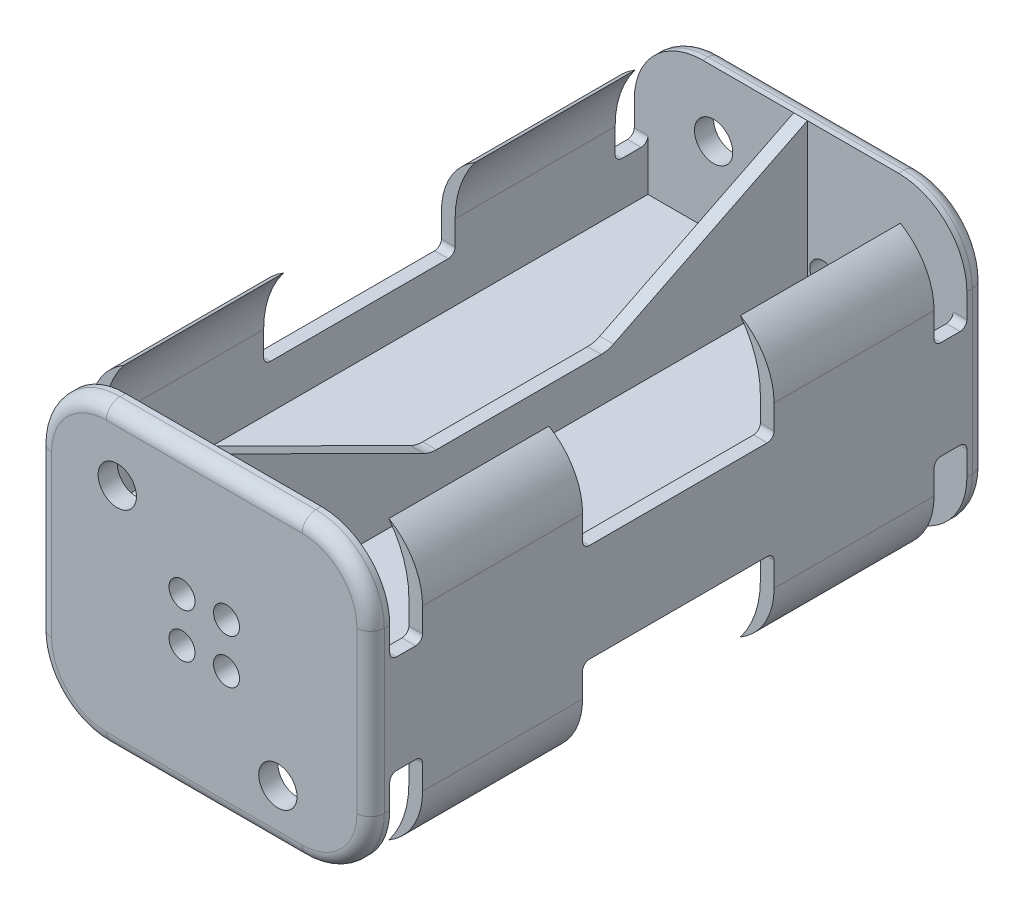
from build123d import *

# Parameters (mm, degrees)
SKETCH1_R           = 1.778
SKETCH1_R_2         = 1.2065
BOSS_EXTRUDE1_DEPTH = 57.15
CUT_EXTRUDE1_DEPTH  = 53.594
CUT_EXTRUDE2_DEPTH  = 8.128
FILLET2_R           = 1.27
FILLET3_R           = 1.27
CUT_EXTRUDE3_DEPTH  = 3.048


with BuildPart() as part:
    # Sketch1 → Boss-Extrude1 (new body)
    with BuildSketch(Plane.XY):
        with BuildLine():
            Line((-9.0932, 13.8049), (9.0932, 13.8049))
            ThreePointArc((9.0932, 13.8049), (13.583328061, 11.945028061), (15.4432, 7.4549))
            Line((15.4432, 7.4549), (15.4432, -7.4549))
            ThreePointArc((15.4432, -7.4549), (13.583328061, -11.945028061), (9.0932, -13.8049))
            Line((9.0932, -13.8049), (-9.0932, -13.8049))
            ThreePointArc((-9.0932, -13.8049), (-13.583328061, -11.945028061), (-15.4432, -7.4549))
            Line((-15.4432, -7.4549), (-15.4432, 7.4549))
            ThreePointArc((-15.4432, 7.4549), (-13.583328061, 11.945028061), (-9.0932, 13.8049))
        make_face()
        with Locations((-8.0772, 7.7851)):
            Circle(SKETCH1_R, mode=Mode.SUBTRACT)
        with Locations(Location((6.834359756, -8.896092883, 0), (0, 0, 180))):
            Circle(SKETCH1_R, mode=Mode.SUBTRACT)
        with Locations((2.065458908, 2.065458908)):
            Circle(SKETCH1_R_2, mode=Mode.SUBTRACT)
        with Locations((2.065458908, -2.065458908)):
            Circle(SKETCH1_R_2, mode=Mode.SUBTRACT)
        with Locations((-2.065458908, -2.065458908)):
            Circle(SKETCH1_R_2, mode=Mode.SUBTRACT)
        with Locations((-2.065458908, 2.065458908)):
            Circle(SKETCH1_R_2, mode=Mode.SUBTRACT)
    extrude(amount=BOSS_EXTRUDE1_DEPTH)

    # Sketch2 → Cut-Extrude1 (cut)
    with BuildSketch(Plane(origin=(0, 0, 1.778), x_dir=(-1, 0, 0), z_dir=(0, 0, -1))):
        with BuildLine():
            Line((-12.315875439, 12.926358947), (-12.315875439, 13.8049))
            Line((-12.315875439, 13.8049), (-0.635, 13.8049))
            Line((-0.635, 13.8049), (-0.635, 0.4699))
            Line((-0.635, 0.4699), (-14.1732, 0.4699))
            Line((-14.1732, 0.4699), (-14.1732, 7.4549))
            ThreePointArc((-14.1732, 7.4549), (-13.696211827, 10.343953372), (-12.315875439, 12.926358947))
        make_face()
        with BuildLine():
            Line((14.1732, 0.4699), (0.635, 0.4699))
            Line((0.635, 0.4699), (0.635, 13.8049))
            Line((0.635, 13.8049), (12.315875439, 13.8049))
            Line((12.315875439, 13.8049), (12.315875439, 12.926358947))
            ThreePointArc((12.315875439, 12.926358947), (13.696211827, 10.343953372), (14.1732, 7.4549))
            Line((14.1732, 7.4549), (14.1732, 0.4699))
        make_face()
        with BuildLine():
            Line((-14.1732, -7.4549), (-14.1732, -0.4699))
            Line((-14.1732, -0.4699), (-0.635, -0.4699))
            Line((-0.635, -0.4699), (-0.635, -13.8049))
            Line((-0.635, -13.8049), (-12.315875439, -13.8049))
            Line((-12.315875439, -13.8049), (-12.315875439, -12.926358947))
            ThreePointArc((-12.315875439, -12.926358947), (-13.696211827, -10.343953372), (-14.1732, -7.4549))
        make_face()
        with BuildLine():
            Line((14.1732, -0.4699), (0.635, -0.4699))
            Line((0.635, -0.4699), (0.635, -13.8049))
            Line((0.635, -13.8049), (12.315875439, -13.8049))
            Line((12.315875439, -13.8049), (12.315875439, -12.926358947))
            ThreePointArc((12.315875439, -12.926358947), (13.696211827, -10.343953372), (14.1732, -7.4549))
            Line((14.1732, -7.4549), (14.1732, -0.4699))
        make_face()
    extrude(amount=-CUT_EXTRUDE1_DEPTH, mode=Mode.SUBTRACT)

    # Sketch3 → Cut-Extrude2 (cut)
    with BuildSketch(Plane.ZY.offset(15.4432)):
        with BuildLine():
            Line((1.778, 12.926358947), (1.778, 5.207))
            ThreePointArc((1.778, 5.207), (1.963987194, 4.757987194), (2.413, 4.572))
            Line((2.413, 4.572), (4.191, 4.572))
            ThreePointArc((4.191, 4.572), (4.640012806, 4.757987194), (4.826, 5.207))
            Line((4.826, 5.207), (4.826, 12.926358947))
            Line((4.826, 12.926358947), (1.778, 12.926358947))
        make_face()
        with BuildLine():
            Line((54.737, 4.572), (52.959, 4.572))
            ThreePointArc((52.959, 4.572), (52.509987194, 4.757987194), (52.324, 5.207))
            Line((52.324, 5.207), (52.324, 12.926358947))
            Line((52.324, 12.926358947), (55.372, 12.926358947))
            Line((55.372, 12.926358947), (55.372, 5.207))
            ThreePointArc((55.372, 5.207), (55.186012806, 4.757987194), (54.737, 4.572))
        make_face()
        with BuildLine():
            Line((2.413, -4.572), (4.191, -4.572))
            ThreePointArc((4.191, -4.572), (4.640012806, -4.757987194), (4.826, -5.207))
            Line((4.826, -5.207), (4.826, -12.926358947))
            Line((4.826, -12.926358947), (1.778, -12.926358947))
            Line((1.778, -12.926358947), (1.778, -5.207))
            ThreePointArc((1.778, -5.207), (1.963987194, -4.757987194), (2.413, -4.572))
        make_face()
        with BuildLine():
            Line((54.737, -4.572), (52.959, -4.572))
            ThreePointArc((52.959, -4.572), (52.509987194, -4.757987194), (52.324, -5.207))
            Line((52.324, -5.207), (52.324, -12.926358947))
            Line((52.324, -12.926358947), (55.372, -12.926358947))
            Line((55.372, -12.926358947), (55.372, -5.207))
            ThreePointArc((55.372, -5.207), (55.186012806, -4.757987194), (54.737, -4.572))
        make_face()
        with BuildLine():
            Line((19.685, 12.926358947), (37.465, 12.926358947))
            Line((37.465, 12.926358947), (37.465, 5.207))
            ThreePointArc((37.465, 5.207), (37.279012806, 4.757987194), (36.83, 4.572))
            Line((36.83, 4.572), (20.32, 4.572))
            ThreePointArc((20.32, 4.572), (19.870987194, 4.757987194), (19.685, 5.207))
            Line((19.685, 5.207), (19.685, 12.926358947))
        make_face()
        with BuildLine():
            Line((37.465, -12.926358947), (37.465, -5.207))
            ThreePointArc((37.465, -5.207), (37.279012806, -4.757987194), (36.83, -4.572))
            Line((36.83, -4.572), (20.32, -4.572))
            ThreePointArc((20.32, -4.572), (19.870987194, -4.757987194), (19.685, -5.207))
            Line((19.685, -5.207), (19.685, -12.926358947))
            Line((19.685, -12.926358947), (37.465, -12.926358947))
        make_face()
    cut_extrude2 = extrude(amount=-CUT_EXTRUDE2_DEPTH, mode=Mode.SUBTRACT)

    # Mirror1: Cut-Extrude2 across plane
    add(cut_extrude2.mirror(Plane(origin=(0, 0, 0), x_dir=(0, 0, 1), z_dir=(1, 0, 0))), mode=Mode.SUBTRACT)

    # Fillet2
    fillet2_edges = [part.edges().sort_by_distance(p)[0] for p in [
        (-13.583328061, 11.945028061, 57.15),
        (-15.4432, 0, 57.15),
        (-13.583328061, -11.945028061, 57.15),
        (0, -13.8049, 57.15),
        (13.583328061, -11.945028061, 57.15),
        (15.4432, 0, 57.15),
        (13.583328061, 11.945028061, 57.15),
        (0, 13.8049, 57.15),
    ]]
    fillet(fillet2_edges, radius=FILLET2_R)

    # Fillet3
    fillet3_edges = [part.edges().sort_by_distance(p)[0] for p in [
        (0, 13.8049, 0),
        (13.583328061, 11.945028061, 0),
        (15.4432, 0, 0),
        (13.583328061, -11.945028061, 0),
        (0, -13.8049, 0),
        (-13.583328061, -11.945028061, 0),
        (-15.4432, 0, 0),
        (-13.583328061, 11.945028061, 0),
    ]]
    fillet(fillet3_edges, radius=FILLET3_R)

    # Sketch4 → Cut-Extrude3 (cut)
    with BuildSketch(Plane(origin=(0.635, 0, 0), x_dir=(0, 0, -1), z_dir=(1, 0, 0))):
        with BuildLine():
            Line((-20.917407266, 4.572), (-36.232592734, 4.572))
            ThreePointArc((-36.232592734, 4.572), (-36.814131461, 4.63946836), (-37.364776122, 4.838289206))
            Line((-37.364776122, 4.838289206), (-55.372, 13.8049))
            Line((-55.372, 13.8049), (-1.778, 13.8049))
            Line((-1.778, 13.8049), (-19.785223878, 4.838289206))
            ThreePointArc((-19.785223878, 4.838289206), (-20.335868539, 4.63946836), (-20.917407266, 4.572))
        make_face()
        with BuildLine():
            Line((-55.372, -13.8049), (-1.778, -13.8049))
            Line((-1.778, -13.8049), (-19.785223878, -4.838289206))
            ThreePointArc((-19.785223878, -4.838289206), (-20.335868539, -4.63946836), (-20.917407266, -4.572))
            Line((-20.917407266, -4.572), (-36.232592734, -4.572))
            ThreePointArc((-36.232592734, -4.572), (-36.814131461, -4.63946836), (-37.364776122, -4.838289206))
            Line((-37.364776122, -4.838289206), (-55.372, -13.8049))
        make_face()
    extrude(amount=-CUT_EXTRUDE3_DEPTH, mode=Mode.SUBTRACT)


solid = part.part
